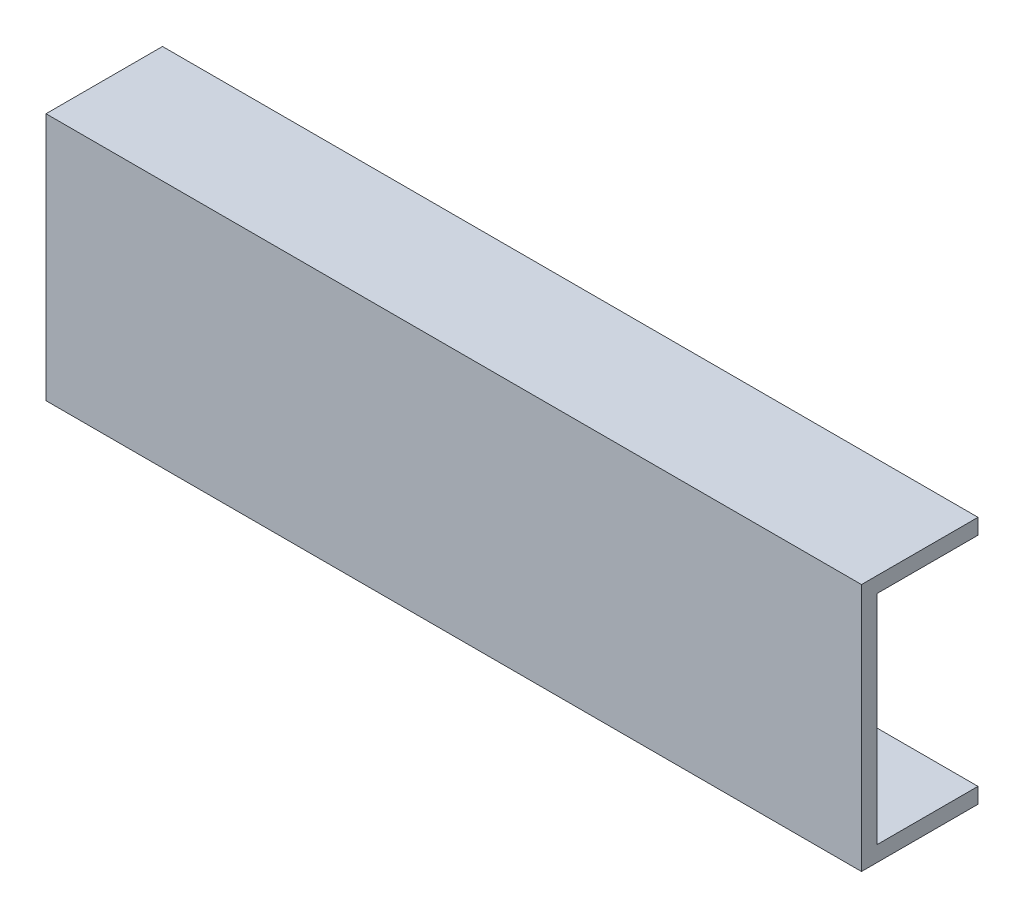
from build123d import *

# Parameters (mm, degrees)
SKETCH_1_W          = 105
SKETCH_1_H          = 32
EXTRUDE_1_DEPTH     = 15
SKETCH_3_W          = 105
SKETCH_3_H          = 28
CUT_EXTRUDE_1_DEPTH = 13


with BuildPart() as part:
    # 草圖1 → 填料-伸長1 (new body)
    with BuildSketch(Plane.XY):
        with Locations((-52.5, 16)):
            Rectangle(SKETCH_1_W, SKETCH_1_H)
    extrude(amount=EXTRUDE_1_DEPTH)

    # 草圖3 → 除料-伸長1 (cut)
    with BuildSketch(Plane(origin=(0, 0, 0), x_dir=(-1, 0, 0), z_dir=(0, 0, -1))):
        with Locations((52.5, 16)):
            Rectangle(SKETCH_3_W, SKETCH_3_H)
    extrude(amount=-CUT_EXTRUDE_1_DEPTH, mode=Mode.SUBTRACT)


solid = part.part
